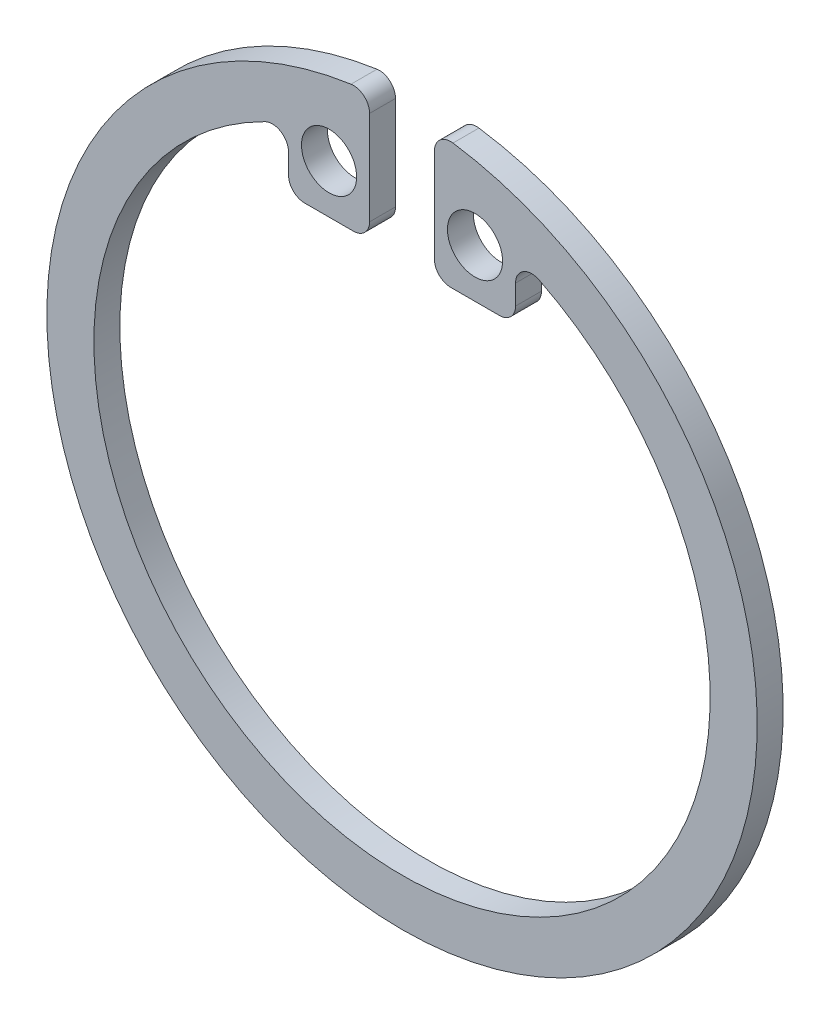
from build123d import *

# Parameters (mm, degrees)
SKETCH1_R           = 10.95
SKETCH1_R_2         = 9.5
BOSS_EXTRUDE1_DEPTH = 0.8
SKETCH2_W           = 2
SKETCH2_H           = 14.789010462
CUT_EXTRUDE1_DEPTH  = 16.506289047
SKETCH3_W           = 2.5
SKETCH3_H           = 2.5
BOSS_EXTRUDE2_DEPTH = 0.8
FILLET1_R           = 0.5
FILLET2_R           = 0.5
SKETCH4_R           = 0.85
CUT_EXTRUDE2_DEPTH  = 16.506289047


with BuildPart() as part:
    # Sketch1 → Boss-Extrude1 (new body)
    with BuildSketch(Plane.XY):
        Circle(SKETCH1_R)
        Circle(SKETCH1_R_2, mode=Mode.SUBTRACT)
    extrude(amount=BOSS_EXTRUDE1_DEPTH)

    # Sketch2 → Cut-Extrude1 (cut, through all)
    with BuildSketch(Plane.XY.offset(0.8)):
        with Locations((0, 7.394505231)):
            Rectangle(SKETCH2_W, SKETCH2_H)
    extrude(amount=-CUT_EXTRUDE1_DEPTH, mode=Mode.SUBTRACT)

    # Sketch3 → Boss-Extrude2 (add)
    with BuildSketch(Plane.XY.offset(0.8)):
        with Locations((2.25, 8.197221814)):
            Rectangle(SKETCH3_W, SKETCH3_H)
        with Locations((-2.25, 8.197221814)):
            Rectangle(SKETCH3_W, SKETCH3_H)
    extrude(amount=-BOSS_EXTRUDE2_DEPTH)

    # Fillet1
    fillet1_edges = [part.edges().sort_by_distance(p)[0] for p in [
        (1, 10.904242294, 0.4),
        (-1, 10.904242294, 0.4),
        (3.5, 8.831760866, 0.4),
        (-3.5, 8.831760866, 0.4),
    ]]
    fillet(fillet1_edges, radius=FILLET1_R)

    # Fillet2
    fillet2_edges = [part.edges().sort_by_distance(p)[0] for p in [
        (1, 6.947221814, 0.4),
        (3.5, 6.947221814, 0.4),
        (-1, 6.947221814, 0.4),
        (-3.5, 6.947221814, 0.4),
    ]]
    fillet(fillet2_edges, radius=FILLET2_R)

    # Sketch4 → Cut-Extrude2 (cut, through all)
    with BuildSketch(Plane.XY.offset(0.8)):
        with Locations((2.25, 8.447221814)):
            Circle(SKETCH4_R)
        with Locations((-2.25, 8.447221814)):
            Circle(SKETCH4_R)
    extrude(amount=-CUT_EXTRUDE2_DEPTH, mode=Mode.SUBTRACT)


solid = part.part
